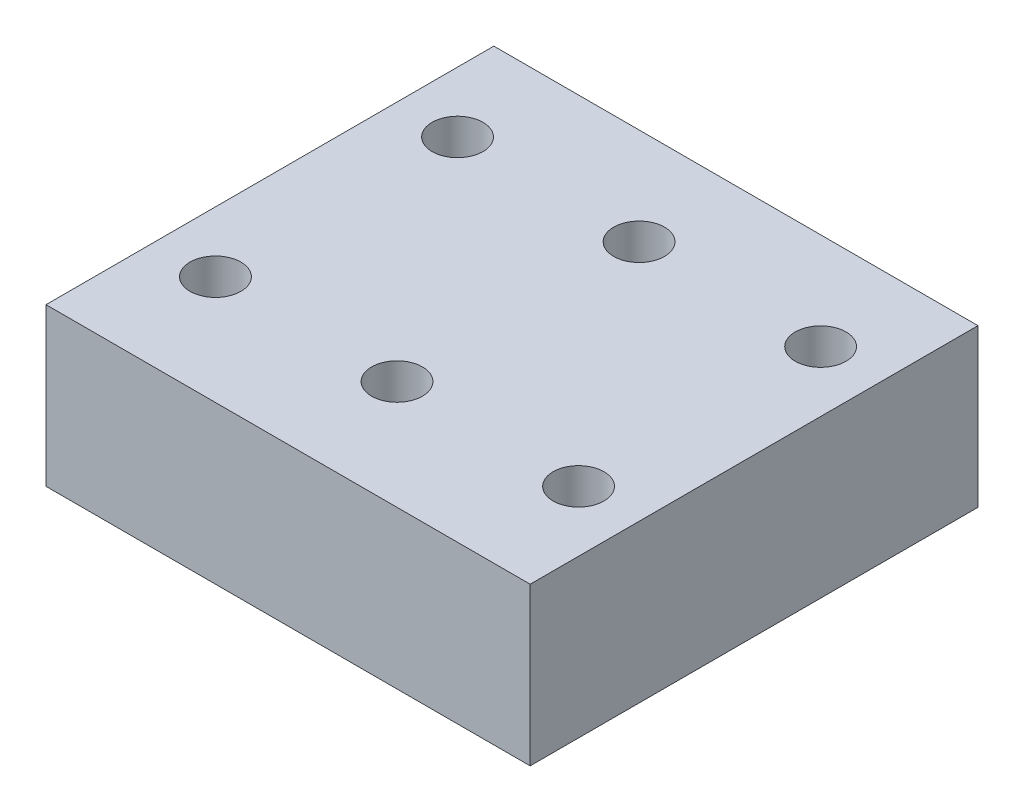
from build123d import *

# Parameters (mm, degrees)
SKETCH_1_W      = 40
SKETCH_1_H      = 37
SKETCH_1_R      = 2.1
EXTRUDE_1_DEPTH = 13


with BuildPart() as part:
    # 草图1 → 凸台-拉伸1 (new body)
    with BuildSketch(Plane(origin=(0, 0, 0), x_dir=(1, 0, 0), z_dir=(0, 1, 0))):
        with Locations((20, -18.5)):
            Rectangle(SKETCH_1_W, SKETCH_1_H)
        with Locations(Location((20, -28, 0), (0, 0, 90))):
            Circle(SKETCH_1_R, mode=Mode.SUBTRACT)
        with Locations(Location((20, -8, 0), (0, 0, 90))):
            Circle(SKETCH_1_R, mode=Mode.SUBTRACT)
        with Locations(Location((35, -8, 0), (0, 0, 90))):
            Circle(SKETCH_1_R, mode=Mode.SUBTRACT)
        with Locations(Location((35, -28, 0), (0, 0, 90))):
            Circle(SKETCH_1_R, mode=Mode.SUBTRACT)
        with Locations(Location((5, -28, 0), (0, 0, 90))):
            Circle(SKETCH_1_R, mode=Mode.SUBTRACT)
        with Locations(Location((5, -8, 0), (0, 0, 90))):
            Circle(SKETCH_1_R, mode=Mode.SUBTRACT)
    extrude(amount=EXTRUDE_1_DEPTH)


solid = part.part
